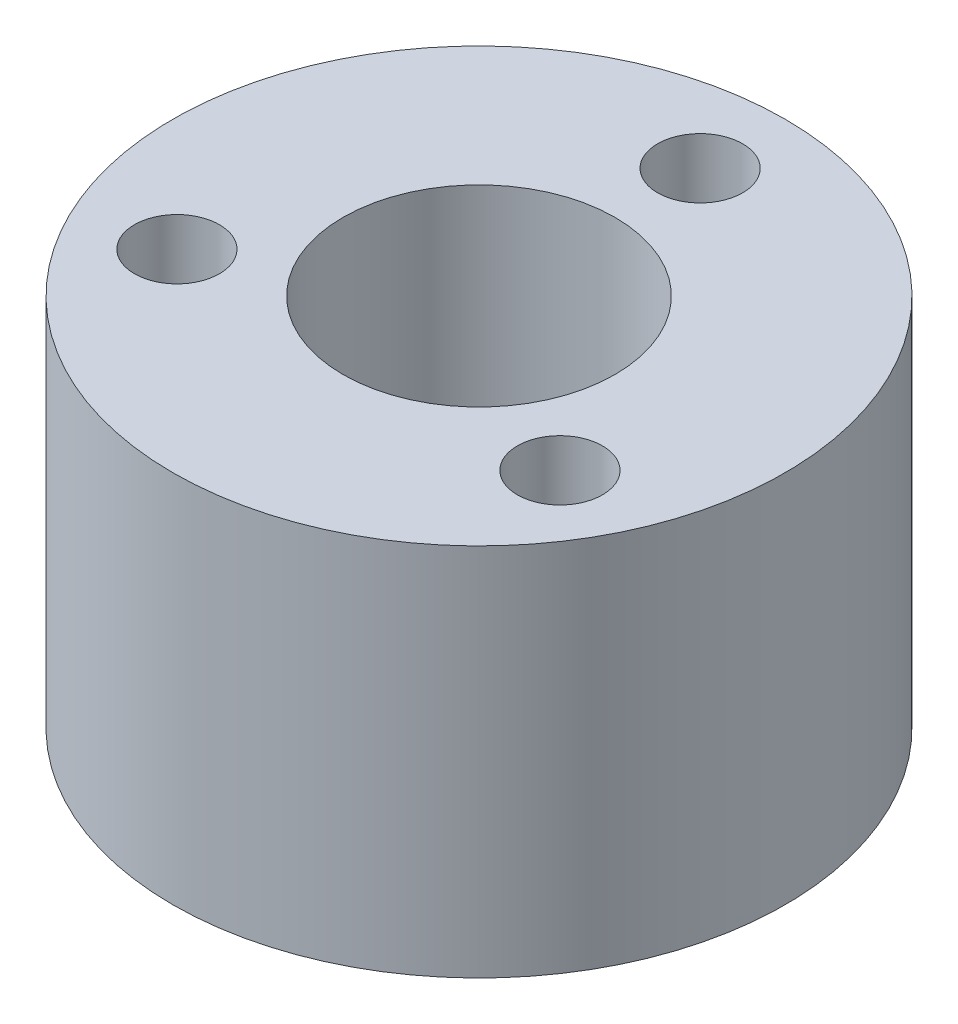
from build123d import *

# Parameters (mm, degrees)
SKETCH_1_R      = 9
SKETCH_1_R_2    = 4
SKETCH_1_R_3    = 1.25
EXTRUDE_1_DEPTH = 11


with BuildPart() as part:
    # 草图1 → 凸台-拉伸1 (new body)
    with BuildSketch(Plane(origin=(0, 0, 0), x_dir=(1, 0, 0), z_dir=(0, 1, 0))):
        with Locations(Location((0, 0, 0), (0, 0, 270))):
            Circle(SKETCH_1_R)
        with Locations(Location((0, 0, 0), (0, 0, 270))):
            Circle(SKETCH_1_R_2, mode=Mode.SUBTRACT)
        with Locations(Location((0, 6.5, 0), (0, 0, 270))):
            Circle(SKETCH_1_R_3, mode=Mode.SUBTRACT)
        with Locations(Location((5.629165125, -3.25, 0), (0, 0, 270))):
            Circle(SKETCH_1_R_3, mode=Mode.SUBTRACT)
        with Locations(Location((-5.629165125, -3.25, 0), (0, 0, 270))):
            Circle(SKETCH_1_R_3, mode=Mode.SUBTRACT)
    extrude(amount=EXTRUDE_1_DEPTH)


solid = part.part
